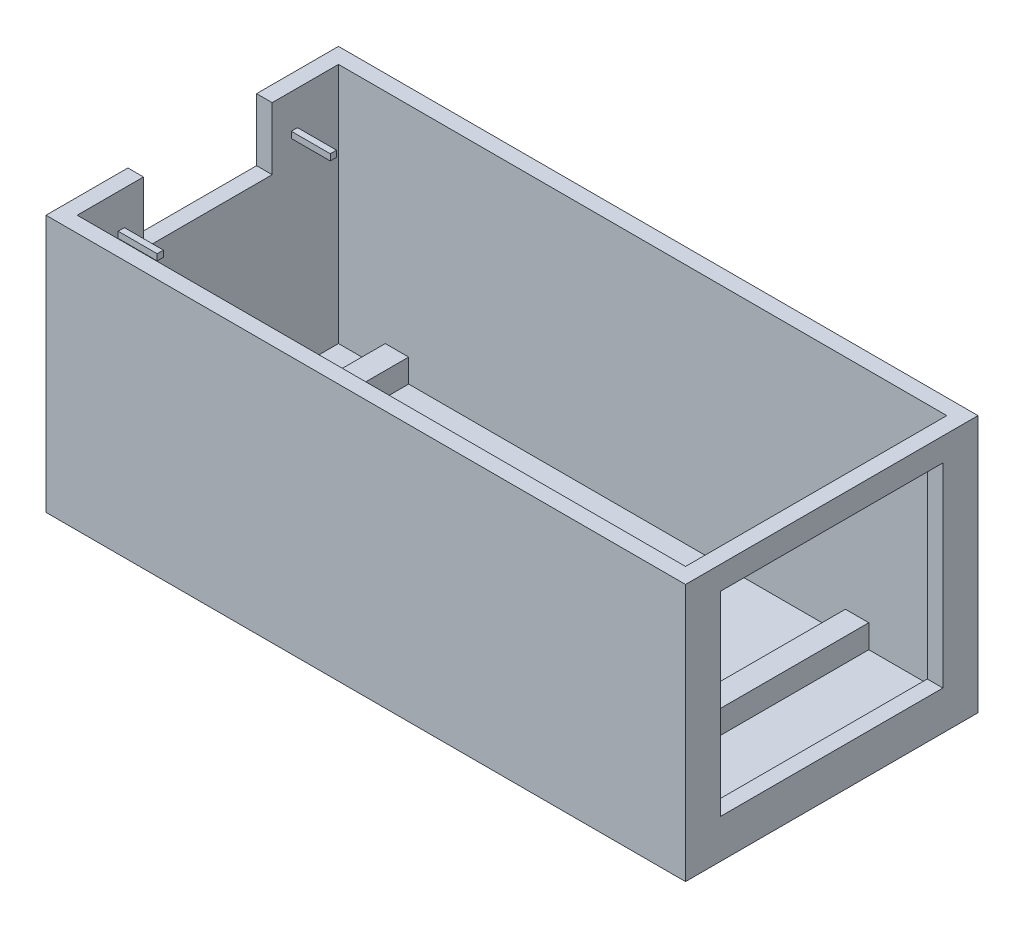
from build123d import *

# Parameters (mm, degrees)
SKETCH1_W           = 82
SKETCH1_H           = 37.5
BOSS_EXTRUDE2_DEPTH = 2
SKETCH2_W           = 3
SKETCH2_H           = 37.5
BOSS_EXTRUDE4_DEPTH = 3
BOSS_EXTRUDE5_DEPTH = 31
SKETCH6_W           = 16.5
SKETCH6_H           = 8
CUT_EXTRUDE1_DEPTH  = 2
SKETCH7_W           = 28.5
SKETCH7_H           = 25
CUT_EXTRUDE2_DEPTH  = 2
SKETCH8_W           = 0.8
SKETCH8_H           = 0.8
BOSS_EXTRUDE6_DEPTH = 5
SKETCH9_W           = 35
SKETCH9_H           = 2
BOSS_EXTRUDE7_DEPTH = 2.4


with BuildPart() as part:
    # Sketch1 → Boss-Extrude2 (new body)
    with BuildSketch(Plane(origin=(0, 0, 0), x_dir=(1, 0, 0), z_dir=(0, 1, 0))):
        with Locations((41, 18.75)):
            Rectangle(SKETCH1_W, SKETCH1_H)
    extrude(amount=BOSS_EXTRUDE2_DEPTH)

    # Sketch2 → Boss-Extrude4 (add)
    with BuildSketch(Plane(origin=(0, 2, 0), x_dir=(1, 0, 0), z_dir=(0, 1, 0))):
        with Locations((9.5, 18.75)):
            Rectangle(SKETCH2_W, SKETCH2_H)
        with Locations((68.5, 18.75)):
            Rectangle(SKETCH2_W, SKETCH2_H)
    extrude(amount=BOSS_EXTRUDE4_DEPTH)

    # Sketch4 → Boss-Extrude5 (add)
    with BuildSketch(Plane(origin=(0, 2, 0), x_dir=(1, 0, 0), z_dir=(0, 1, 0))):
        Polygon((11, 37.5), (8, 37.5), (0, 37.5), (0, 0), (8, 0), (11, 0), (67, 0), (70, 0), (82, 0), (82, 37.5), (70, 37.5), (67, 37.5), align=None)
        Polygon((2, 2), (2, 35.5), (8, 35.5), (11, 35.5), (67, 35.5), (70, 35.5), (80, 35.5), (80, 2), (70, 2), (67, 2), (11, 2), (8, 2), align=None, mode=Mode.SUBTRACT)
    extrude(amount=BOSS_EXTRUDE5_DEPTH)

    # Sketch6 → Cut-Extrude1 (cut)
    with BuildSketch(Plane.ZY):
        with Locations((-18.75, 29)):
            Rectangle(SKETCH6_W, SKETCH6_H)
    extrude(amount=-CUT_EXTRUDE1_DEPTH, mode=Mode.SUBTRACT)

    # Sketch7 → Cut-Extrude2 (cut)
    with BuildSketch(Plane(origin=(82, 0, 0), x_dir=(0, 0, -1), z_dir=(1, 0, 0))):
        with Locations((18.75, 17.5)):
            Rectangle(SKETCH7_W, SKETCH7_H)
    extrude(amount=-CUT_EXTRUDE2_DEPTH, mode=Mode.SUBTRACT)

    # Sketch8 → Boss-Extrude6 (add)
    with BuildSketch(Plane(origin=(2, 0, 0), x_dir=(0, 0, -1), z_dir=(1, 0, 0))):
        with Locations((7.65, 28.2)):
            Rectangle(SKETCH8_W, SKETCH8_H)
        with Locations((29.85, 28.2)):
            Rectangle(SKETCH8_W, SKETCH8_H)
    extrude(amount=BOSS_EXTRUDE6_DEPTH)

    # Sketch9 → Boss-Extrude7 (add)
    with BuildSketch(Plane(origin=(0, 0, -37.5), x_dir=(-1, 0, 0), z_dir=(0, 0, -1))):
        with Locations((-55.5, 26)):
            Rectangle(SKETCH9_W, SKETCH9_H)
        with Locations((-55.5, 5)):
            Rectangle(SKETCH9_W, SKETCH9_H)
    extrude(amount=BOSS_EXTRUDE7_DEPTH)


solid = part.part
